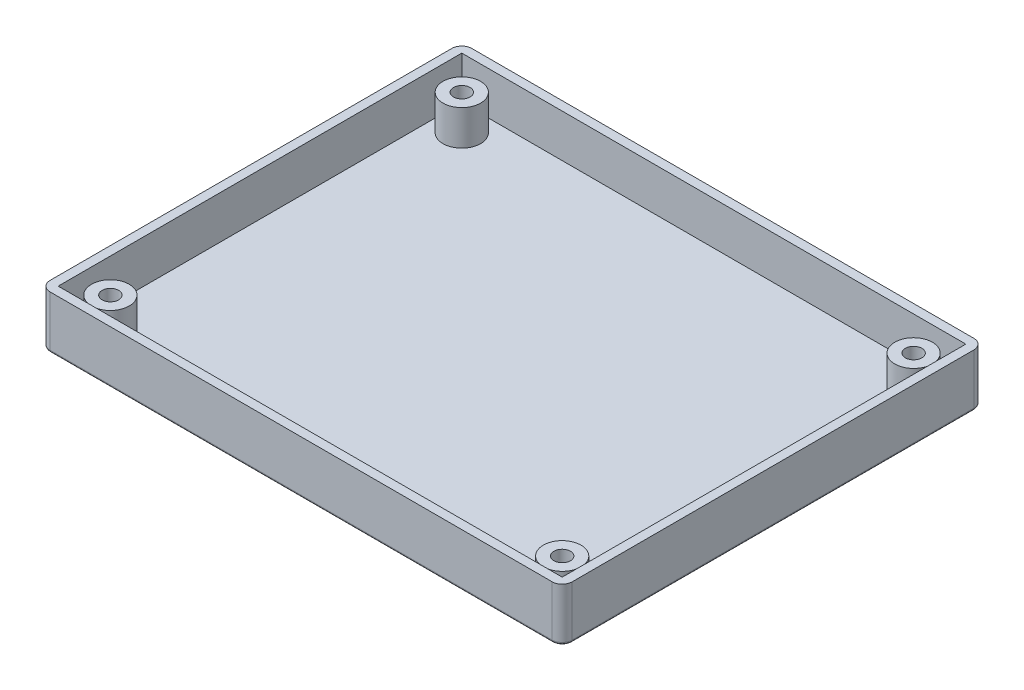
from build123d import *

# Parameters (mm, degrees)
ESQUISSE1_W             = 104
ESQUISSE1_H             = 84
BOSS_EXTRU_1_DEPTH      = 2
ESQUISSE2_R             = 3.75
BOSS_EXTRU_2_DEPTH      = 7
ESQUISSE3_W             = 104
ESQUISSE3_H             = 84
ESQUISSE3_W_2           = 100.4
ESQUISSE3_H_2           = 80.4
BOSS_EXTRU_3_DEPTH      = 8.55
ESQUISSE4_R             = 1.65
ENL_V_MAT_EXTRU_1_DEPTH = 68.446274916
ENL_V_MAT_EXTRU_2_DEPTH = 3
CONG_1_R                = 2
CONG_2_R                = 0.5


with BuildPart() as part:
    # Esquisse1 → Boss.-Extru.1 (new body)
    with BuildSketch(Plane(origin=(0, 0, 0), x_dir=(1, 0, 0), z_dir=(0, 1, 0))):
        Rectangle(ESQUISSE1_W, ESQUISSE1_H)
    extrude(amount=BOSS_EXTRU_1_DEPTH)

    # Esquisse2 → Boss.-Extru.2 (add)
    with BuildSketch(Plane(origin=(0, 2, 0), x_dir=(1, 0, 0), z_dir=(0, 1, 0))):
        with Locations(Location((-45, 35, 0), (0, 0, 270))):
            Circle(ESQUISSE2_R)
        with Locations(Location((45, 35, 0), (0, 0, 270))):
            Circle(ESQUISSE2_R)
        with Locations(Location((45, -35, 0), (0, 0, 270))):
            Circle(ESQUISSE2_R)
        with Locations(Location((-45, -35, 0), (0, 0, 270))):
            Circle(ESQUISSE2_R)
    extrude(amount=BOSS_EXTRU_2_DEPTH)

    # Esquisse3 → Boss.-Extru.3 (add)
    with BuildSketch(Plane(origin=(0, 2, 0), x_dir=(1, 0, 0), z_dir=(0, 1, 0))):
        Rectangle(ESQUISSE3_W, ESQUISSE3_H)
        Rectangle(ESQUISSE3_W_2, ESQUISSE3_H_2, mode=Mode.SUBTRACT)
    extrude(amount=BOSS_EXTRU_3_DEPTH)

    # Esquisse4 → Enlèv. mat.-Extru.1 (cut, through all)
    with BuildSketch(Plane(origin=(0, 9, 0), x_dir=(1, 0, 0), z_dir=(0, 1, 0))):
        with Locations(Location((-45, 35, 0), (0, 0, 270))):
            Circle(ESQUISSE4_R)
        with Locations(Location((45, 35, 0), (0, 0, 270))):
            Circle(ESQUISSE4_R)
        with Locations(Location((45, -35, 0), (0, 0, 270))):
            Circle(ESQUISSE4_R)
        with Locations(Location((-45, -35, 0), (0, 0, 270))):
            Circle(ESQUISSE4_R)
    extrude(amount=-ENL_V_MAT_EXTRU_1_DEPTH, mode=Mode.SUBTRACT)

    # Esquisse5 → Enlèv. mat.-Extru.2 (cut)
    with BuildSketch(Plane.XZ):
        Polygon((-43.397853003, 32.225), (-41.795706006, 35), (-43.397853003, 37.775), (-46.602146997, 37.775), (-48.204293994, 35), (-46.602146997, 32.225), align=None)
        Polygon((43.397853003, 32.225), (46.602146997, 32.225), (48.204293994, 35), (46.602146997, 37.775), (43.397853003, 37.775), (41.795706006, 35), align=None)
        Polygon((43.397853003, -32.225), (41.795706006, -35), (43.397853003, -37.775), (46.602146997, -37.775), (48.204293994, -35), (46.602146997, -32.225), align=None)
        Polygon((-46.602146997, -32.225), (-48.204293994, -35), (-46.602146997, -37.775), (-43.397853003, -37.775), (-41.795706006, -35), (-43.397853003, -32.225), align=None)
    extrude(amount=-ENL_V_MAT_EXTRU_2_DEPTH, mode=Mode.SUBTRACT)

    # Congé1
    cong_1_edges = [part.edges().sort_by_distance(p)[0] for p in [
        (-52, 5.275, -42),
        (52, 5.275, -42),
        (52, 5.275, 42),
        (-52, 5.275, 42),
    ]]
    fillet(cong_1_edges, radius=CONG_1_R)

    # Congé2
    cong_2_edges = [part.edges().sort_by_distance(p)[0] for p in [
        (-52, 0, 0),
        (0, 0, -42),
        (52, 0, 0),
        (0, 0, 42),
        (51.414213562, 0, 41.414213562),
        (51.414213562, 0, -41.414213562),
        (-51.414213562, 0, 41.414213562),
        (-51.414213562, 0, -41.414213562),
    ]]
    fillet(cong_2_edges, radius=CONG_2_R)


solid = part.part
